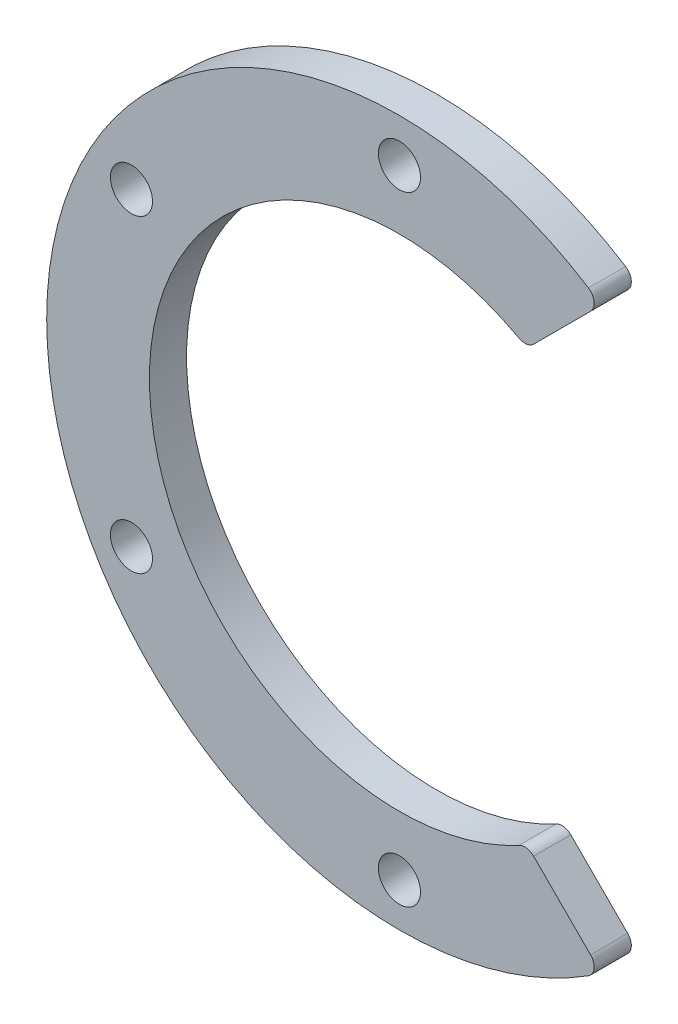
from build123d import *

# Parameters (mm, degrees)
SKETCH_1_R      = 1.7
EXTRUDE_1_DEPTH = 3


with BuildPart() as part:
    # 草图1 → 凸台-拉伸1 (new body)
    with BuildSketch(Plane(origin=(0, 0, 0), x_dir=(-1, 0, 0), z_dir=(0, 0, -1))):
        with BuildLine():
            Line((-15.441425808, 22.51249362), (-10.842226699, 17.91329451))
            ThreePointArc((-10.842226699, 17.91329451), (-10.278098339, 17.630675486), (-9.657048223, 17.742080476))
            ThreePointArc((-9.657048223, 17.742080476), (20.2, 0), (-9.657048223, -17.742080476))
            ThreePointArc((-9.657048223, -17.742080476), (-10.278098339, -17.630675486), (-10.842226699, -17.91329451))
            Line((-10.842226699, -17.91329451), (-15.441425808, -22.51249362))
            ThreePointArc((-15.441425808, -22.51249362), (-15.728277814, -23.329354358), (-15.270112446, -24.063949507))
            ThreePointArc((-15.270112446, -24.063949507), (28.5, 0), (-15.270112446, 24.063949507))
            ThreePointArc((-15.270112446, 24.063949507), (-15.728277814, 23.329354358), (-15.441425808, 22.51249362))
        make_face()
        with Locations(Location((0, 25, 0), (0, 0, 180))):
            Circle(SKETCH_1_R, mode=Mode.SUBTRACT)
        with Locations(Location((0, -25, 0), (0, 0, 180))):
            Circle(SKETCH_1_R, mode=Mode.SUBTRACT)
        with Locations(Location((21.650635095, 12.5, 0), (0, 0, 180))):
            Circle(SKETCH_1_R, mode=Mode.SUBTRACT)
        with Locations(Location((21.650635095, -12.5, 0), (0, 0, 180))):
            Circle(SKETCH_1_R, mode=Mode.SUBTRACT)
    extrude(amount=-EXTRUDE_1_DEPTH)


solid = part.part
